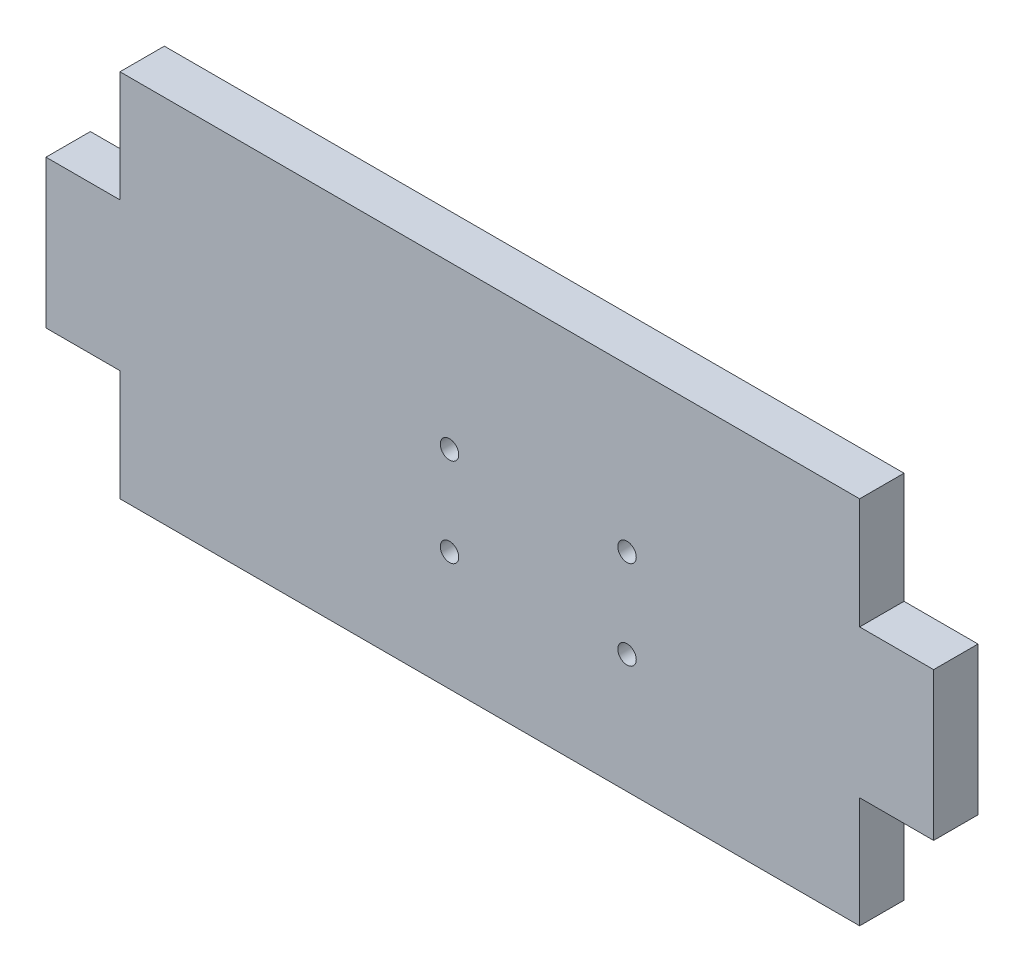
from build123d import *

# Parameters (mm, degrees)
ESQUISSE1_W             = 10
ESQUISSE1_H             = 20
ESQUISSE1_W_2           = 100
ESQUISSE1_H_2           = 50
BOSS_EXTRU_1_DEPTH      = 6
ESQUISSE2_R             = 1.25
ENL_V_MAT_EXTRU_1_DEPTH = 6
ESQUISSE3_R             = 2.5
ENL_V_MAT_EXTRU_2_DEPTH = 4


with BuildPart() as part:
    # Esquisse1 → Boss.-Extru.1 (new body)
    with BuildSketch(Plane.XY):
        with Locations((-5, 25)):
            Rectangle(ESQUISSE1_W, ESQUISSE1_H)
        with Locations((50, 25)):
            Rectangle(ESQUISSE1_W_2, ESQUISSE1_H_2)
        with Locations((105, 25)):
            Rectangle(ESQUISSE1_W, ESQUISSE1_H)
    extrude(amount=BOSS_EXTRU_1_DEPTH)

    # Esquisse2 → Enlèv. mat.-Extru.1 (cut)
    with BuildSketch(Plane(origin=(0, 0, 0), x_dir=(-1, 0, 0), z_dir=(0, 0, -1))):
        with Locations((-44.550340057, 16.065313345)):
            Circle(ESQUISSE2_R)
        with Locations((-44.550340057, 28.065313345)):
            Circle(ESQUISSE2_R)
        with Locations((-68.550340057, 28.065313345)):
            Circle(ESQUISSE2_R)
        with Locations((-68.550340057, 16.065313345)):
            Circle(ESQUISSE2_R)
    extrude(amount=-ENL_V_MAT_EXTRU_1_DEPTH, mode=Mode.SUBTRACT)

    # Esquisse3 → Enlèv. mat.-Extru.2 (cut)
    with BuildSketch(Plane(origin=(0, 0, 0), x_dir=(-1, 0, 0), z_dir=(0, 0, -1))):
        with Locations((-68.550340057, 28.065313345)):
            Circle(ESQUISSE3_R)
        with Locations((-44.550340057, 28.065313345)):
            Circle(ESQUISSE3_R)
        with Locations((-44.550340057, 16.065313345)):
            Circle(ESQUISSE3_R)
        with Locations((-68.550340057, 16.065313345)):
            Circle(ESQUISSE3_R)
    extrude(amount=-ENL_V_MAT_EXTRU_2_DEPTH, mode=Mode.SUBTRACT)


solid = part.part
